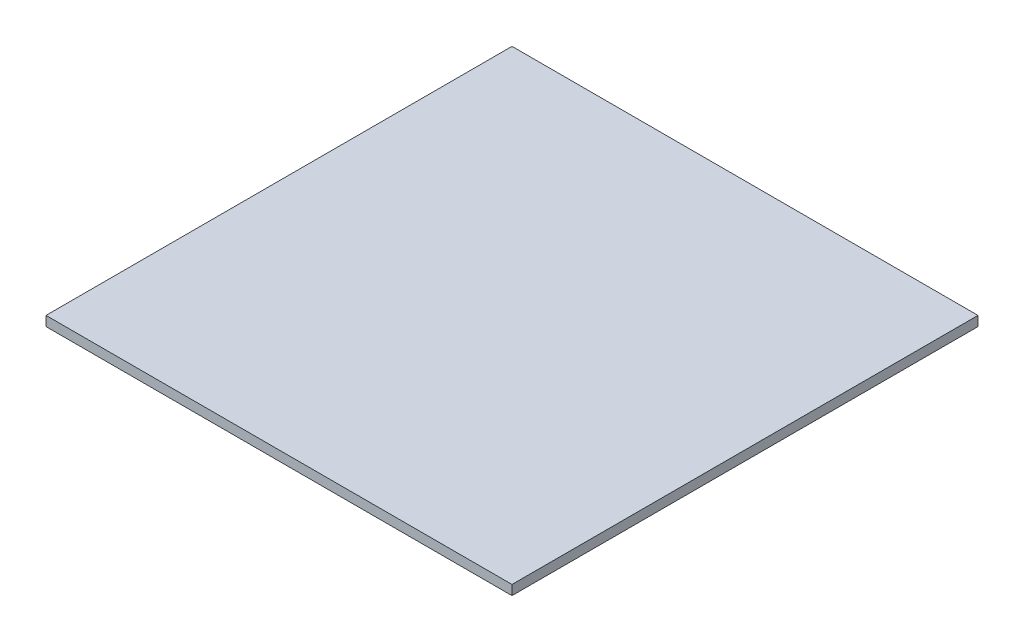
from build123d import *

# Parameters (mm, degrees)
SKETCH1_W           = 152.4
SKETCH1_H           = 3.175
BOSS_EXTRUDE1_DEPTH = 76.2


with BuildPart() as part:
    # Sketch1 → Boss-Extrude1 (new, symmetric)
    with BuildSketch(Plane.XY):
        Rectangle(SKETCH1_W, SKETCH1_H)
    extrude(amount=BOSS_EXTRUDE1_DEPTH, both=True)


solid = part.part
